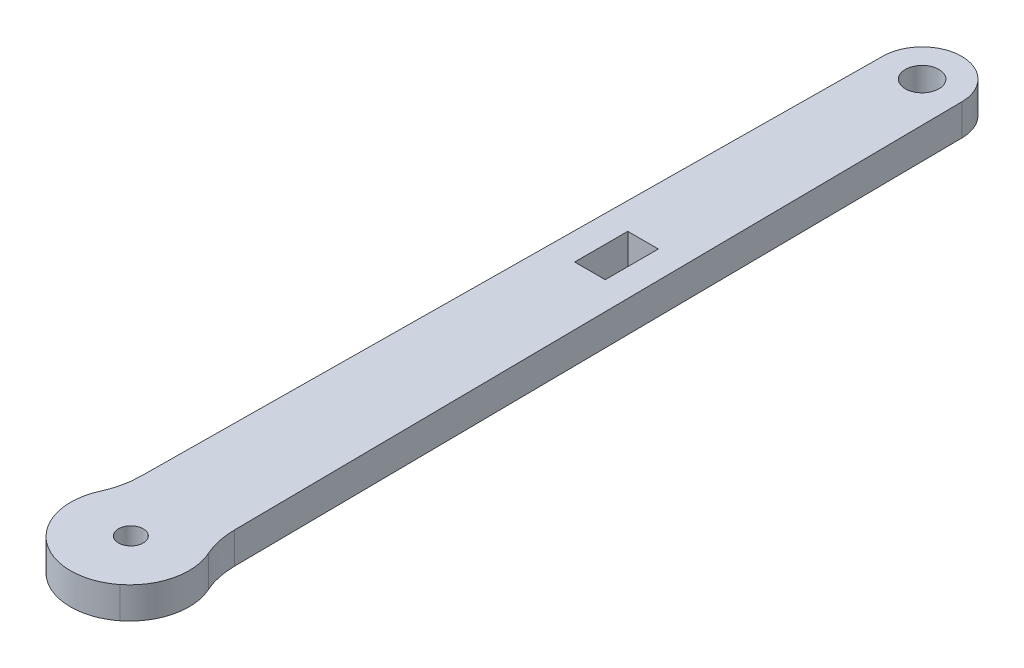
from build123d import *

# Parameters (mm, degrees)
SKETCH1_R           = 1.25
SKETCH1_R_2         = 1.7
SKETCH1_W           = 3.094140016
SKETCH1_H           = 5.373555218
BOSS_EXTRUDE1_DEPTH = 3.175


with BuildPart() as part:
    # Sketch1 → Boss-Extrude1 (new body)
    with BuildSketch(Plane(origin=(0, 0, 0), x_dir=(1, 0, 0), z_dir=(0, 1, 0))):
        with BuildLine():
            Line((-17.941505014, -36.612657571), (-17.206282158, 37.679843625))
            add(Edge.make_bspline(
                [(-17.206282158, 37.679843625), (-17.184484201, 39.873471894), (-15.40321289, 41.64043003), (-13.213298132, 41.640234704)],
                knots=[5, 5, 5, 5, 6, 6, 6, 6], degree=3))
            add(Edge.make_bspline(
                [(-13.213298132, 41.640234704), (-11.02326639, 41.639863585), (-9.242112063, 39.872749187), (-9.220957516, 37.67906232)],
                knots=[6, 6, 6, 6, 7, 7, 7, 7], degree=3))
            Line((-9.220957516, 37.67906232), (-8.499207286, -36.613556071))
            add(Edge.make_bspline(
                [(-8.499207286, -36.613556071), (-8.488347302, -37.73638763), (-8.242642606, -38.944342263), (-7.775936264, -39.965467569)],
                knots=[8, 8, 8, 8, 9, 9, 9, 9], degree=3))
            add(Edge.make_bspline(
                [(-7.775936264, -39.965467569), (-6.625031446, -42.484421072), (-7.34506592, -45.465496377), (-9.518291008, -47.178573835)],
                knots=[0, 0, 0, 0, 1, 1, 1, 1], degree=3))
            add(Edge.make_bspline(
                [(-9.518291008, -47.178573835), (-11.691730567, -48.891651292), (-14.753212643, -48.891270406), (-16.926262256, -47.177802296)],
                knots=[1, 1, 1, 1, 2, 2, 2, 2], degree=3))
            add(Edge.make_bspline(
                [(-16.926262256, -47.177802296), (-19.099292372, -45.464412317), (-19.818819916, -42.483141686), (-18.667408168, -39.96438351)],
                knots=[2, 2, 2, 2, 3, 3, 3, 3], degree=3))
            add(Edge.make_bspline(
                [(-18.667408168, -39.96438351), (-18.200701827, -38.943443763), (-17.952559971, -37.73548913), (-17.941505014, -36.612657571)],
                knots=[3, 3, 3, 3, 4, 4, 4, 4], degree=3))
        make_face()
        with Locations(Location((-13.22099956, -42.362850164, 0), (0, 0, 270))):
            Circle(SKETCH1_R, mode=Mode.SUBTRACT)
        with Locations(Location((-13.213483356, 37.640055716, 0), (0, 0, 270))):
            Circle(SKETCH1_R_2, mode=Mode.SUBTRACT)
        with Locations((-13.219946705, 6.743495147)):
            Rectangle(SKETCH1_W, SKETCH1_H, mode=Mode.SUBTRACT)
    extrude(amount=BOSS_EXTRUDE1_DEPTH)


solid = part.part
